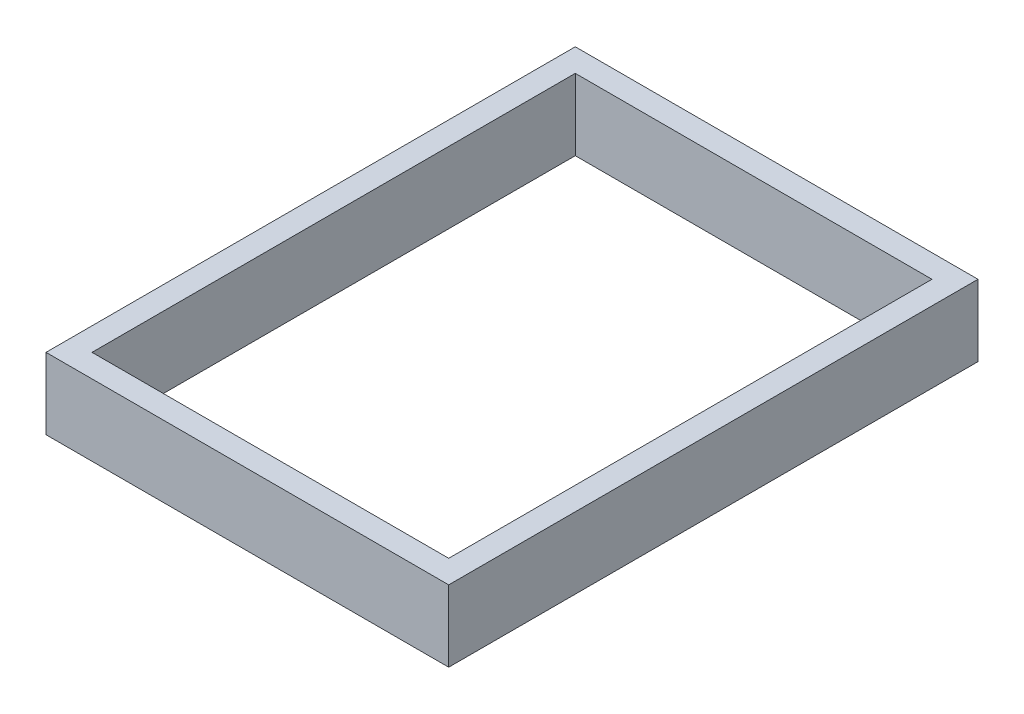
from build123d import *

# Parameters (mm, degrees)
SKETCH1_W           = 310
SKETCH1_H           = 20
SKETCH1_W_2         = 20
SKETCH1_H_2         = 460
BOSS_EXTRUDE1_DEPTH = 62


with BuildPart() as part:
    # Sketch1 → Boss-Extrude1 (new body)
    with BuildSketch(Plane(origin=(0, 0, 0), x_dir=(1, 0, 0), z_dir=(0, 1, 0))):
        with Locations((175, 10)):
            Rectangle(SKETCH1_W, SKETCH1_H)
        with Locations((10, 230)):
            Rectangle(SKETCH1_W_2, SKETCH1_H_2)
        with Locations((175, 450)):
            Rectangle(SKETCH1_W, SKETCH1_H)
        Polygon((330, 20), (330, 0), (350, 0), (350, 460), (330, 460), (330, 440), align=None)
    extrude(amount=BOSS_EXTRUDE1_DEPTH)


solid = part.part
